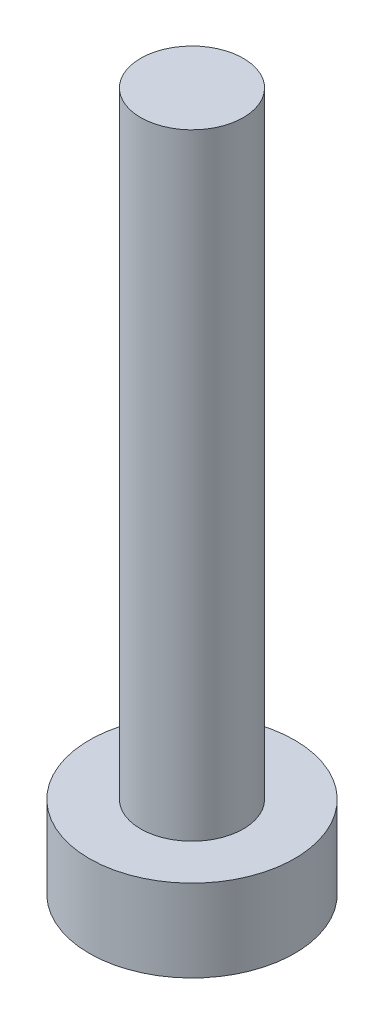
from build123d import *

# Parameters (mm, degrees)
SKETCH1_R           = 2
SKETCH1_R_2         = 1
BOSS_EXTRUDE1_DEPTH = 1.6
BOSS_EXTRUDE2_START = 1.6
SKETCH1_3_R         = 1
BOSS_EXTRUDE2_DEPTH = 12


with BuildPart() as part:
    # Sketch1 → Boss-Extrude1 (new body)
    # profile 1 of 2: a face of its own
    with BuildSketch(Plane(origin=(0, 0, 0), x_dir=(1, 0, 0), z_dir=(0, 1, 0))):
        with Locations(Location((0, 0, 0), (0, 0, 270))):
            Circle(SKETCH1_R)
        Circle(SKETCH1_R_2, mode=Mode.SUBTRACT)
    # profile 2 of 2: a face of its own
    with BuildSketch(Plane(origin=(0, 0, 0), x_dir=(1, 0, 0), z_dir=(0, 1, 0))):
        Circle(SKETCH1_R_2)
    extrude(amount=BOSS_EXTRUDE1_DEPTH)

    # Sketch1<3> → Boss-Extrude2 (add)
    with BuildSketch(Plane(origin=(0, 0, 0), x_dir=(1, 0, 0), z_dir=(0, 1, 0)).offset(BOSS_EXTRUDE2_START)):
        with Locations(Location((0, 0, 0), (0, 0, 270))):
            Circle(SKETCH1_3_R)
    extrude(amount=BOSS_EXTRUDE2_DEPTH)


solid = part.part
